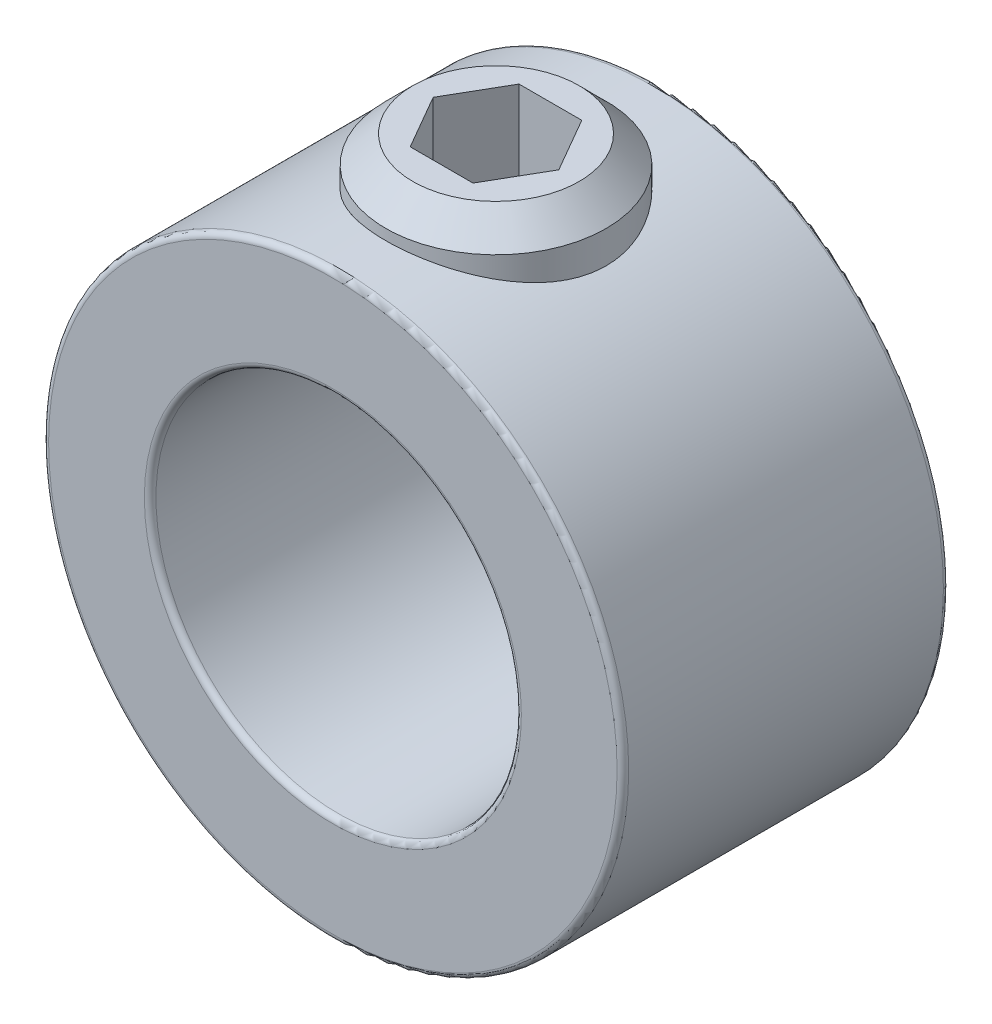
from build123d import *

# Parameters (mm, degrees)
SKETCH1_R          = 6.35
SKETCH1_R_2        = 4
EXTRUDE1_DEPTH     = 3.571875
SKETCH2_R          = 2.413
CUT_EXTRUDE1_DEPTH = 49.179055782
FILLET1_R          = 0.127
CUT_EXTRUDE2_DEPTH = 2.38125


with BuildPart() as part:
    # Sketch1 → Extrude1 (new, symmetric)
    with BuildSketch(Plane.XY):
        Circle(SKETCH1_R)
        Circle(SKETCH1_R_2, mode=Mode.SUBTRACT)
    extrude(amount=EXTRUDE1_DEPTH, both=True)

    # Sketch2 → Cut-Extrude1 (cut, through all)
    with BuildSketch(Plane(origin=(41.275, 0, 0), x_dir=(0, 0, -1), z_dir=(0, -1, 0))):
        with Locations((0, -41.275)):
            Circle(SKETCH2_R)
    extrude(amount=-CUT_EXTRUDE1_DEPTH, mode=Mode.SUBTRACT)

    # Fillet1
    fillet1_edges = [part.edges().sort_by_distance(p)[0] for p in [
        (-6.35, 0, -3.571875),
        (-6.35, 0, 3.571875),
        (-4, 0, -3.571875),
        (-4, 0, 3.571875),
    ]]
    fillet(fillet1_edges, radius=FILLET1_R)


with BuildPart() as body_2:
    # Sketch3 → Revolve1 (revolve)
    with BuildSketch(Plane.XY):
        Polygon((-1.819751616, 4), (-0.71189806, 4), (0, 4.71189806), (0, 7.175), (-1.819751616, 7.175), (-2.413, 6.581751616), (-2.413, 4.593248384), align=None)
    revolve(axis=Axis((0, 4, 0), (0, -1, 0)))

    # Sketch4 → Cut-Extrude2 (cut)
    with BuildSketch(Plane(origin=(3.3734375, 7.175, 0), x_dir=(0, 0, -1), z_dir=(0, -1, 0))):
        Polygon((0, -1.998622171), (-1.190625, -2.686029836), (-1.190625, -4.060845164), (0, -4.748252829), (1.190625, -4.060845164), (1.190625, -2.686029836), align=None)
    extrude(amount=CUT_EXTRUDE2_DEPTH, mode=Mode.SUBTRACT)


solid = Compound([part.part, body_2.part])
